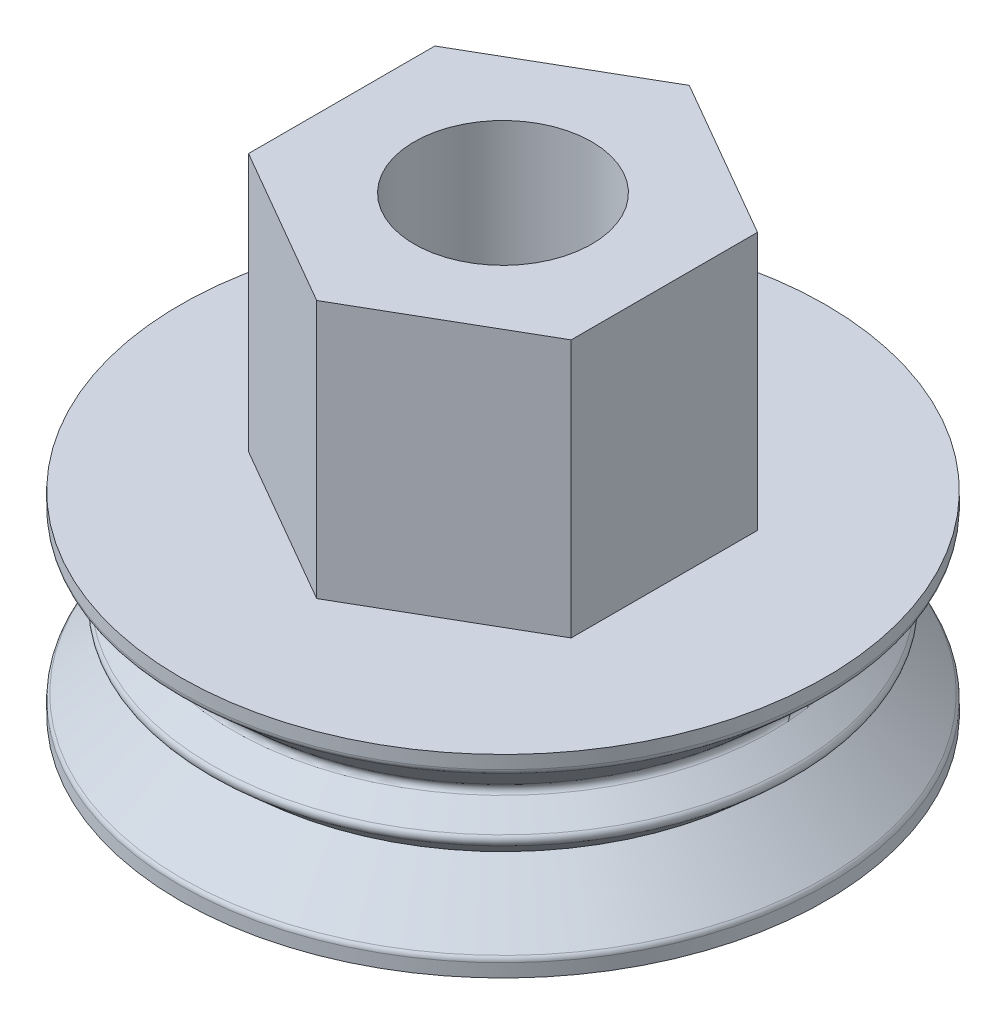
from build123d import *

# Parameters (mm, degrees)
BOSS_EXTRUDE1_DEPTH = 10.16
FILLET1_R           = 0.254
SKETCH4_R           = 3.4925
CUT_EXTRUDE1_DEPTH  = 26.272681003


with BuildPart() as part:
    # Sketch1 → Boss-Extrude1 (new body)
    with BuildSketch(Plane(origin=(0, 0, 0), x_dir=(1, 0, 0), z_dir=(0, 1, 0))):
        Polygon((0, 7.332348419), (-6.35, 3.666174209), (-6.35, -3.666174209), (0, -7.332348419), (6.35, -3.666174209), (6.35, 3.666174209), align=None)
    extrude(amount=BOSS_EXTRUDE1_DEPTH)

    # Sketch3 → Revolve1 (revolve)
    with BuildSketch(Plane.XY, mode=Mode.PRIVATE) as revolve1_sk:
        Polygon((0, 0), (-12.7, 0), (-12.7, -0.635), (-10.399064962, -2.680813959), (-11.669064962, -3.81), (-10.399064962, -4.939186041), (-12.7, -6.985), (-12.7, -7.62), (0, -7.62), align=None)
    revolve(revolve1_sk.sketch.rotate(Axis((0, -7.62, 0), (0, 1, 0)), 270), axis=Axis((0, -7.62, 0), (0, 1, 0)))

    # Fillet1
    fillet1_edges = [part.edges().sort_by_distance(p)[0] for p in [
        (0, -0.635, 12.7),
        (0, -2.680813959, 10.399064962),
        (0, -3.81, 11.669064962),
        (0, -6.985, 12.7),
    ]]
    fillet(fillet1_edges, radius=FILLET1_R)

    # Sketch4 → Cut-Extrude1 (cut, through all)
    with BuildSketch(Plane.XZ.offset(7.62)):
        with Locations(Location((0, 0, 0), (0, 0, 270))):
            Circle(SKETCH4_R)
    extrude(amount=-CUT_EXTRUDE1_DEPTH, mode=Mode.SUBTRACT)


solid = part.part
